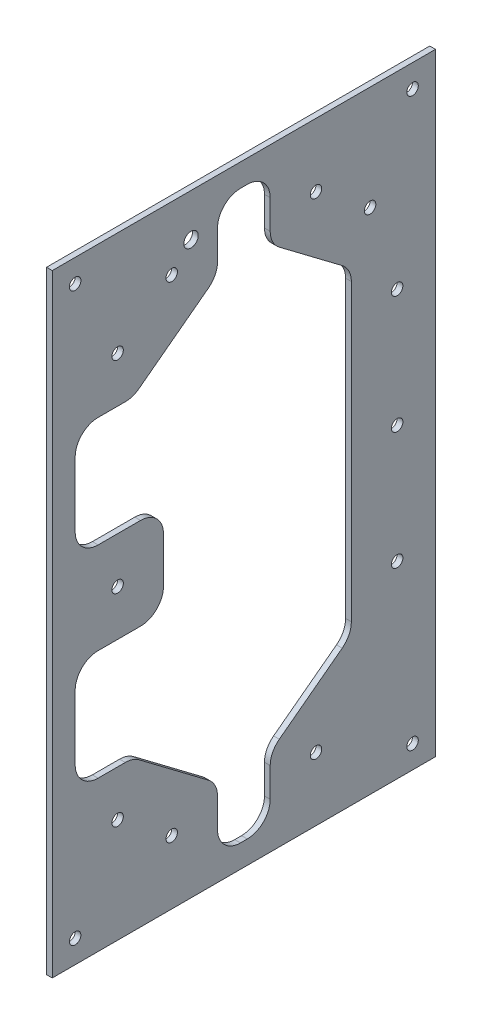
from build123d import *

# Parameters (mm, degrees)
SKETCH1_W           = 212.5
SKETCH1_H           = 339.725
SKETCH1_R           = 3.175
BOSS_EXTRUDE1_DEPTH = 3.175
CUT_EXTRUDE1_DEPTH  = 401.72360331
SKETCH3_R           = 4
CUT_EXTRUDE2_DEPTH  = 45.72
SKETCH4_R           = 4
CUT_EXTRUDE3_DEPTH  = 14.986


with BuildPart() as part:
    # Sketch1 → Boss-Extrude1 (new body)
    with BuildSketch(Plane(origin=(0, 0, 0), x_dir=(0, 0, -1), z_dir=(1, 0, 0))):
        with Locations((106.25, -169.8625)):
            Rectangle(SKETCH1_W, SKETCH1_H)
        with Locations((12.7, -12.7)):
            Circle(SKETCH1_R, mode=Mode.SUBTRACT)
        with Locations((199.8, -12.7)):
            Circle(SKETCH1_R, mode=Mode.SUBTRACT)
        with Locations((66.25, -35.2425)):
            Circle(SKETCH1_R, mode=Mode.SUBTRACT)
        with Locations((146.25, -35.2425)):
            Circle(SKETCH1_R, mode=Mode.SUBTRACT)
        with Locations((176.25, -57.8625)):
            Circle(SKETCH1_R, mode=Mode.SUBTRACT)
        with Locations((36.25, -57.8625)):
            Circle(SKETCH1_R, mode=Mode.SUBTRACT)
        with Locations((191.25, -104.5325)):
            Circle(SKETCH1_R, mode=Mode.SUBTRACT)
        with Locations((36.25, -169.8625)):
            Circle(SKETCH1_R, mode=Mode.SUBTRACT)
        with Locations((191.25, -169.8625)):
            Circle(SKETCH1_R, mode=Mode.SUBTRACT)
        with Locations((36.25, -281.8625)):
            Circle(SKETCH1_R, mode=Mode.SUBTRACT)
        with Locations((66.25, -304.4825)):
            Circle(SKETCH1_R, mode=Mode.SUBTRACT)
        with Locations((12.7, -327.025)):
            Circle(SKETCH1_R, mode=Mode.SUBTRACT)
        with Locations((199.8, -327.025)):
            Circle(SKETCH1_R, mode=Mode.SUBTRACT)
        with Locations((146.25, -304.4825)):
            Circle(SKETCH1_R, mode=Mode.SUBTRACT)
        with Locations(Location((191.25, -235.1925, 0), (0, 0, 180))):
            Circle(SKETCH1_R, mode=Mode.SUBTRACT)
    extrude(amount=BOSS_EXTRUDE1_DEPTH)

    # Sketch2 → Cut-Extrude1 (cut, through all)
    with BuildSketch(Plane(origin=(3.175, 0, 0), x_dir=(0, 0, -1), z_dir=(1, 0, 0))):
        with BuildLine():
            Line((165.85, -88.161695758), (165.85, -251.563304242))
            ThreePointArc((165.85, -251.563304242), (164.516472011, -257.22840036), (160.795934799, -261.703801323))
            Line((160.795934799, -261.703801323), (125.904065201, -288.012271))
            ThreePointArc((125.904065201, -288.012271), (122.183527989, -292.487671963), (120.85, -298.152768081))
            Line((120.85, -298.152768081), (120.85, -314.325))
            ThreePointArc((120.85, -314.325), (117.130256121, -323.305256121), (108.15, -327.025))
            Line((108.15, -327.025), (104.35, -327.025))
            ThreePointArc((104.35, -327.025), (95.369743879, -323.305256121), (91.65, -314.325))
            Line((91.65, -314.325), (91.65, -298.152768081))
            ThreePointArc((91.65, -298.152768081), (90.316472011, -292.487671963), (86.595934799, -288.012271))
            Line((86.595934799, -288.012271), (48.147303392, -259.022002919))
            ThreePointArc((48.147303392, -259.022002919), (44.532850149, -257.119362682), (40.501368593, -256.4625))
            Line((40.501368593, -256.4625), (25.4, -256.4625))
            ThreePointArc((25.4, -256.4625), (16.419743879, -252.742756121), (12.7, -243.7625))
            Line((12.7, -243.7625), (12.7, -207.9625))
            ThreePointArc((12.7, -207.9625), (16.419743879, -198.982243879), (25.4, -195.2625))
            Line((25.4, -195.2625), (48.95, -195.2625))
            ThreePointArc((48.95, -195.2625), (57.930256121, -191.542756121), (61.65, -182.5625))
            Line((61.65, -182.5625), (61.65, -157.1625))
            ThreePointArc((61.65, -157.1625), (57.930256121, -148.182243879), (48.95, -144.4625))
            Line((48.95, -144.4625), (25.4, -144.4625))
            ThreePointArc((25.4, -144.4625), (16.419743879, -140.742756121), (12.7, -131.7625))
            Line((12.7, -131.7625), (12.7, -95.9625))
            ThreePointArc((12.7, -95.9625), (16.419743879, -86.982243879), (25.4, -83.2625))
            Line((25.4, -83.2625), (40.501368593, -83.2625))
            ThreePointArc((40.501368593, -83.2625), (44.532850149, -82.605637318), (48.147303392, -80.702997081))
            Line((48.147303392, -80.702997081), (86.595934799, -51.712729))
            ThreePointArc((86.595934799, -51.712729), (90.316472011, -47.237328037), (91.65, -41.572231919))
            Line((91.65, -41.572231919), (91.65, -25.4))
            ThreePointArc((91.65, -25.4), (95.369743879, -16.419743879), (104.35, -12.7))
            Line((104.35, -12.7), (108.15, -12.7))
            ThreePointArc((108.15, -12.7), (117.130256121, -16.419743879), (120.85, -25.4))
            Line((120.85, -25.4), (120.85, -41.572231919))
            ThreePointArc((120.85, -41.572231919), (122.183527989, -47.237328037), (125.904065201, -51.712729))
            Line((125.904065201, -51.712729), (160.795934799, -78.021198677))
            ThreePointArc((160.795934799, -78.021198677), (164.516472011, -82.49659964), (165.85, -88.161695758))
        make_face()
    extrude(amount=-CUT_EXTRUDE1_DEPTH, mode=Mode.SUBTRACT)

    # Sketch3 → Cut-Extrude2 (cut)
    with BuildSketch(Plane.ZY):
        with Locations((-353.343139499, -302.41374809)):
            Circle(SKETCH3_R)
    extrude(amount=-CUT_EXTRUDE2_DEPTH, mode=Mode.SUBTRACT)

    # Sketch4 → Cut-Extrude3 (cut)
    with BuildSketch(Plane.ZY):
        with Locations((-76.9625, -23.613540107)):
            Circle(SKETCH4_R)
    extrude(amount=-CUT_EXTRUDE3_DEPTH, mode=Mode.SUBTRACT)


solid = part.part
